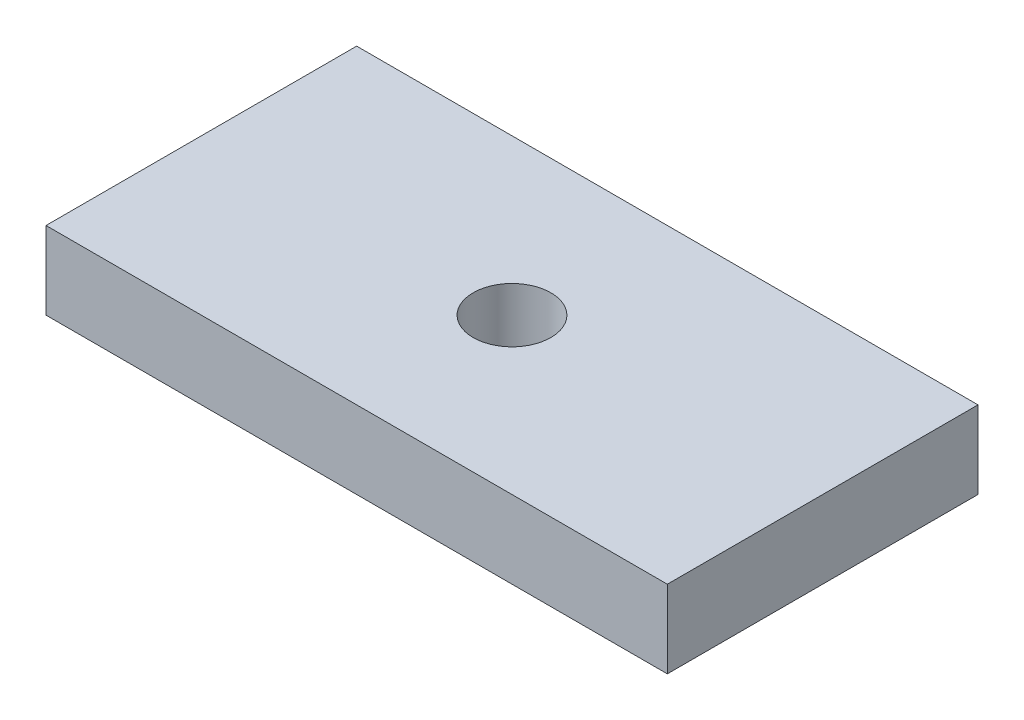
from build123d import *

# Parameters (mm, degrees)
SKETCH1_W           = 25.4
SKETCH1_H           = 12.7
BOSS_EXTRUDE1_DEPTH = 3.175
SKETCH2_R           = 1.5875
CUT_EXTRUDE1_DEPTH  = 29.575


with BuildPart() as part:
    # Sketch1 → Boss-Extrude1 (new body)
    with BuildSketch(Plane(origin=(0, 0, 0), x_dir=(1, 0, 0), z_dir=(0, 1, 0))):
        with Locations((12.7, 6.35)):
            Rectangle(SKETCH1_W, SKETCH1_H)
    extrude(amount=BOSS_EXTRUDE1_DEPTH)

    # Sketch2 → Cut-Extrude1 (cut, through all)
    with BuildSketch(Plane(origin=(0, 3.175, 0), x_dir=(1, 0, 0), z_dir=(0, 1, 0))):
        with Locations(Location((12.7, 6.35, 0), (0, 0, 270))):
            Circle(SKETCH2_R)
    extrude(amount=-CUT_EXTRUDE1_DEPTH, mode=Mode.SUBTRACT)


solid = part.part
